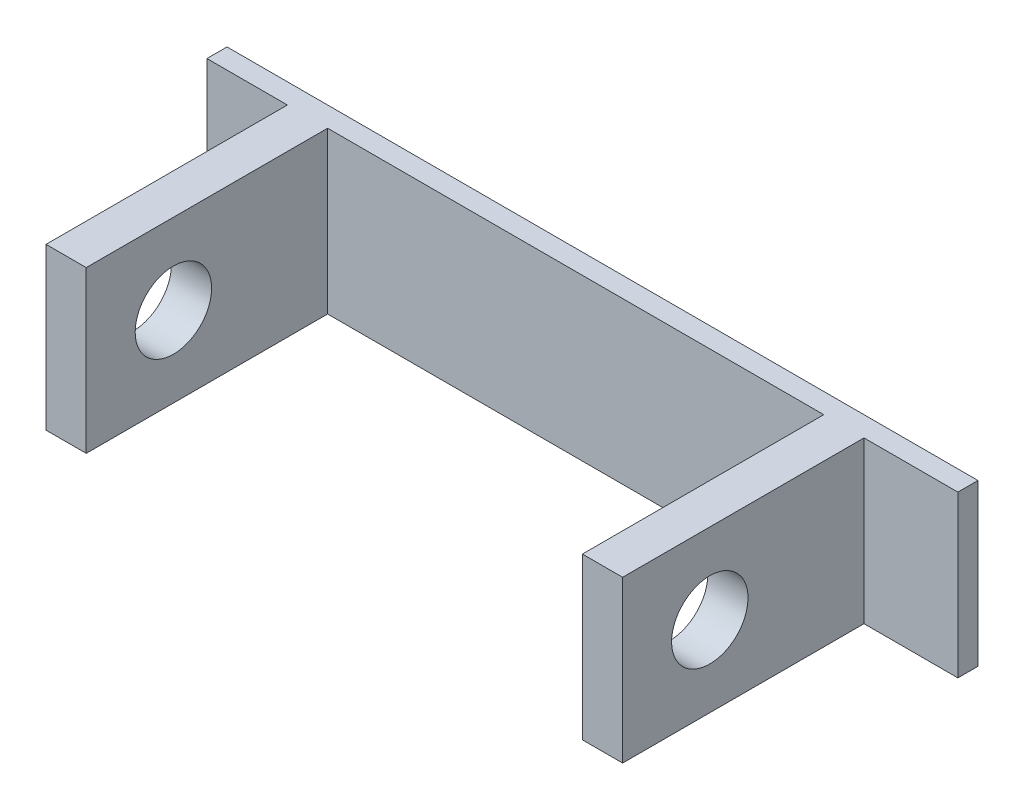
from build123d import *

# Parameters (mm, degrees)
SKETCH_2_W          = 56
SKETCH_2_H          = 12
EXTRUDE_1_DEPTH     = 1.5
SKETCH_3_W          = 3
SKETCH_3_H          = 12
EXTRUDE_2_DEPTH     = 18
SKETCH_4_R          = 2.85
CUT_EXTRUDE_1_DEPTH = 54.077773126


with BuildPart() as part:
    # 草图2 → 凸台-拉伸1 (new body)
    with BuildSketch(Plane.XY):
        Rectangle(SKETCH_2_W, SKETCH_2_H)
    extrude(amount=EXTRUDE_1_DEPTH)

    # 草图3 → 凸台-拉伸2 (add)
    with BuildSketch(Plane.XY.offset(1.5)):
        with Locations((-20.5, 0)):
            Rectangle(SKETCH_3_W, SKETCH_3_H)
        with Locations((19.5, 0)):
            Rectangle(SKETCH_3_W, SKETCH_3_H)
    extrude(amount=EXTRUDE_2_DEPTH)

    # 草图4 → 切除-拉伸1 (cut, through all)
    with BuildSketch(Plane(origin=(21, 0, 0), x_dir=(0, 0, -1), z_dir=(1, 0, 0))):
        with Locations(Location((-13, 0, 0), (0, 0, 90))):
            Circle(SKETCH_4_R)
    extrude(amount=-CUT_EXTRUDE_1_DEPTH, mode=Mode.SUBTRACT)


solid = part.part
